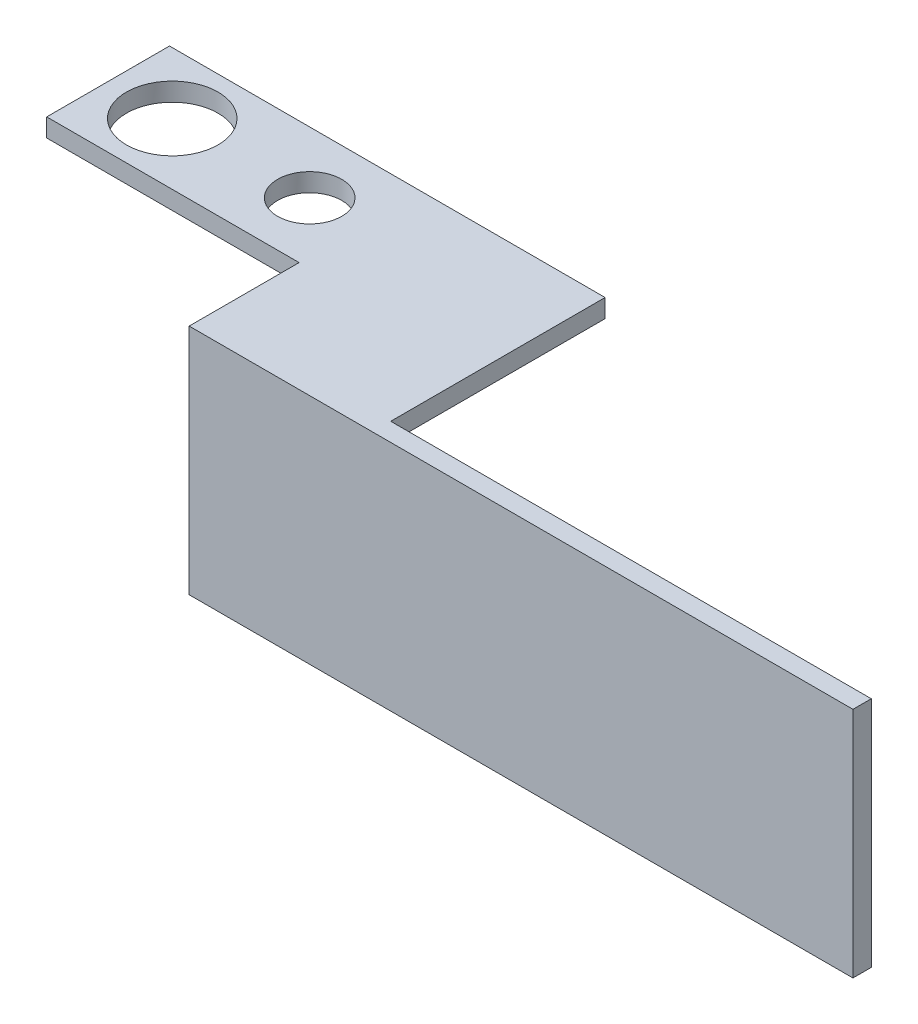
from build123d import *

# Parameters (mm, degrees)
SALIENTE_EXTRUIR1_DEPTH = 100
CROQUIS3_R              = 5
CROQUIS3_R_2            = 3.5
CROQUIS3_W              = 52.452137676
CROQUIS3_H              = 23.4
CORTAR_EXTRUIR1_DEPTH   = 2
CORTAR_EXTRUIR2_REACH   = 107.333
CROQUIS4_W              = 27.547862324
CROQUIS4_H              = 23.4


with BuildPart() as part:
    # Croquis2 → Saliente-Extruir1 (new body)
    with BuildSketch(Plane(origin=(0, 0, 0), x_dir=(0, 0, -1), z_dir=(1, 0, 0))):
        Polygon((0, 0), (-21.4, 0), (-21.4, -21.4), (-21.4, -23.4), (-23.4, -23.4), (-23.4, 2), (2, 2), (2, 0), align=None)
    extrude(amount=SALIENTE_EXTRUIR1_DEPTH)

    # Croquis3 → Cortar-Extruir1 (cut)
    with BuildSketch(Plane(origin=(0, 2, 0), x_dir=(1, 0, 0), z_dir=(0, 1, 0))):
        with Locations(Location((7, -4.7, 0), (0, 0, 270))):
            Circle(CROQUIS3_R)
        with Locations(Location((22, -4.7, 0), (0, 0, 270))):
            Circle(CROQUIS3_R_2)
        with Locations((73.773931162, -9.7)):
            Rectangle(CROQUIS3_W, CROQUIS3_H)
        Polygon((0, -21.4), (0, -11.4), (27.547862324, -11.4), (27.547862324, -21.4), (27.547862324, -23.4), (0, -23.4), align=None)
    extrude(amount=-CORTAR_EXTRUIR1_DEPTH, mode=Mode.SUBTRACT)

    # Croquis4 → Cortar-Extruir2 (cut, up to next)
    with BuildSketch(Plane(origin=(0, 0, 21.4), x_dir=(-1, 0, 0), z_dir=(0, 0, -1)), mode=Mode.PRIVATE) as cortar_extruir2_sk1:
        with Locations((-13.773931162, -11.7)):
            Rectangle(CROQUIS4_W, CROQUIS4_H)
    cortar_extruir2_tool1 = extrude(cortar_extruir2_sk1.sketch, amount=-CORTAR_EXTRUIR2_REACH, mode=Mode.PRIVATE) & part.part
    add(cortar_extruir2_tool1.solids().sort_by_distance((13.773931, -11.7, 21.4))[0], mode=Mode.SUBTRACT)


solid = part.part
